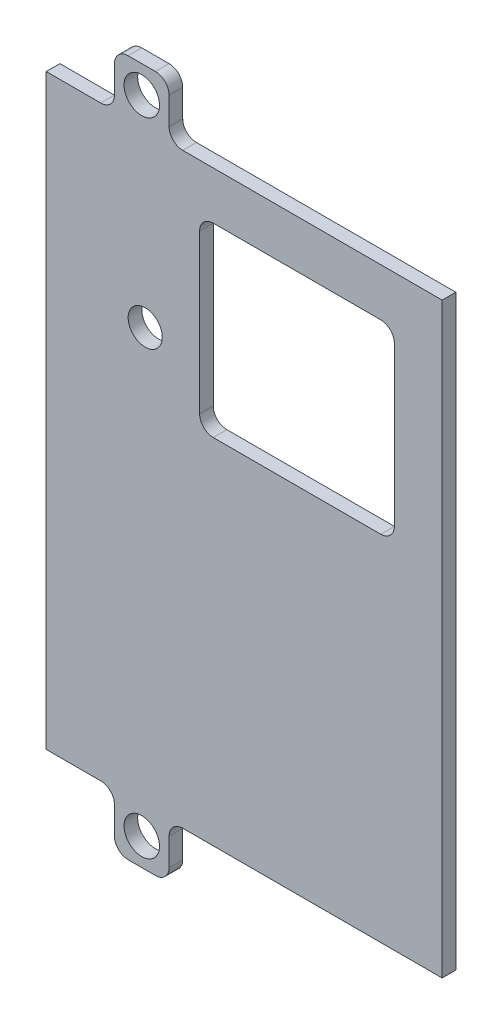
from build123d import *

# Parameters (mm, degrees)
SKETCH1_R           = 3.302
SKETCH1_R_2         = 3.175
SKETCH1_W           = 36.231873889
SKETCH1_H           = 34.54456272
BOSS_EXTRUDE1_DEPTH = 2.54
SKETCH3_W           = 9.144
SKETCH3_H           = 3.81
BOSS_EXTRUDE2_DEPTH = 8.89
FILLET1_R           = 2.54


with BuildPart() as part:
    # Sketch1 → Boss-Extrude1 (new body)
    with BuildSketch(Plane.XY):
        with BuildLine():
            Line((19.05, 113.03), (19.05, 107.95))
            ThreePointArc((19.05, 107.95), (19.793948776, 106.153948776), (21.59, 105.41))
            Line((21.59, 105.41), (69.85, 105.41))
            Line((69.85, 105.41), (69.85, -3.81))
            Line((69.85, -3.81), (21.59, -3.81))
            ThreePointArc((21.59, -3.81), (19.793948776, -4.553948776), (19.05, -6.35))
            Line((19.05, -6.35), (19.05, -11.43))
            ThreePointArc((19.05, -11.43), (18.306051224, -13.226051224), (16.51, -13.97))
            Line((16.51, -13.97), (11.43, -13.97))
            ThreePointArc((11.43, -13.97), (9.633948776, -13.226051224), (8.89, -11.43))
            Line((8.89, -11.43), (8.89, -6.35))
            ThreePointArc((8.89, -6.35), (8.146051224, -4.553948776), (6.35, -3.81))
            Line((6.35, -3.81), (-3.81, -3.81))
            Line((-3.81, -3.81), (-3.81, 105.41))
            Line((-3.81, 105.41), (6.35, 105.41))
            ThreePointArc((6.35, 105.41), (8.146051224, 106.153948776), (8.89, 107.95))
            Line((8.89, 107.95), (8.89, 113.03))
            ThreePointArc((8.89, 113.03), (9.633948776, 114.826051224), (11.43, 115.57))
            Line((11.43, 115.57), (16.51, 115.57))
            ThreePointArc((16.51, 115.57), (18.306051224, 114.826051224), (19.05, 113.03))
        make_face()
        with Locations((13.97, 110.49)):
            Circle(SKETCH1_R, mode=Mode.SUBTRACT)
        with Locations((13.97, -8.89)):
            Circle(SKETCH1_R, mode=Mode.SUBTRACT)
        with Locations((14.607116803, 73.380830868)):
            Circle(SKETCH1_R_2, mode=Mode.SUBTRACT)
        with Locations((42.844063056, 79.24771864)):
            Rectangle(SKETCH1_W, SKETCH1_H, mode=Mode.SUBTRACT)
    extrude(amount=BOSS_EXTRUDE1_DEPTH)

    # Sketch3 → Boss-Extrude2 (add)
    with BuildSketch(Plane(origin=(0, 0, 0), x_dir=(-1, 0, 0), z_dir=(0, 0, -1))):
        with Locations((-42.418, -1.905)):
            Rectangle(SKETCH3_W, SKETCH3_H)
    extrude(amount=BOSS_EXTRUDE2_DEPTH)

    # Fillet1
    fillet1_edges = [part.edges().sort_by_distance(p)[0] for p in [
        (24.728126111, 61.97543728, 1.27),
        (60.96, 61.97543728, 1.27),
        (60.96, 96.52, 1.27),
        (24.728126111, 96.52, 1.27),
    ]]
    fillet(fillet1_edges, radius=FILLET1_R)


solid = part.part
